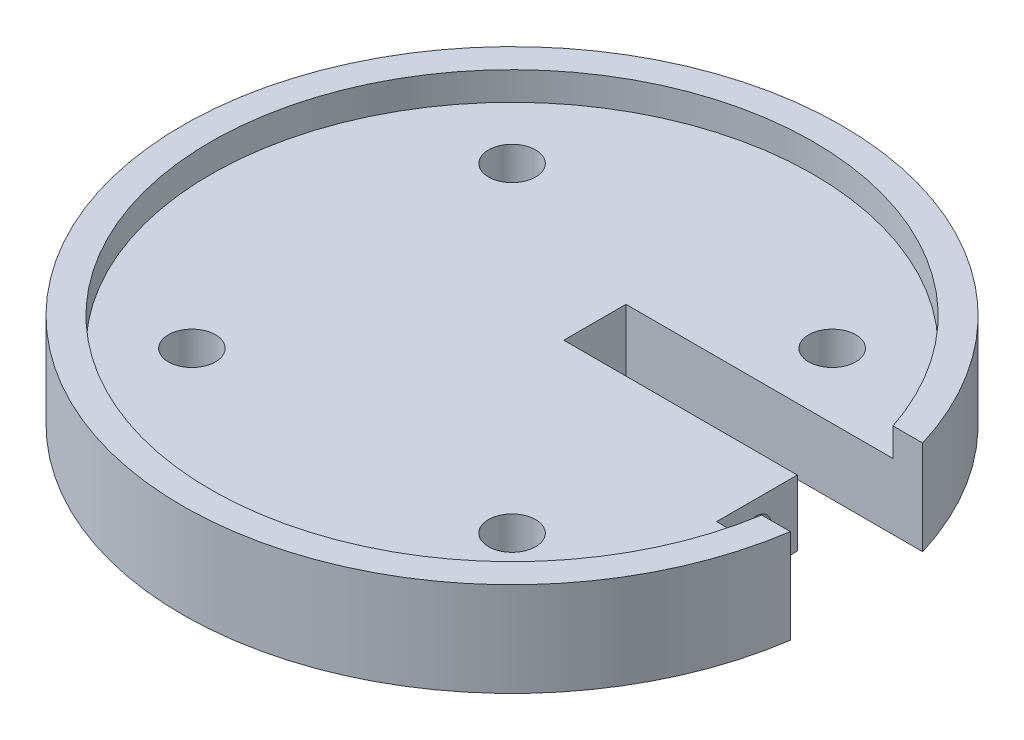
from build123d import *

# Parameters (mm, degrees)
SKETCH1_R               = 35
BOSS_EXTRUDE1_DEPTH     = 10
SKETCH27_W              = 8.45046724
SKETCH27_H              = 8.572937779
CUT_EXTRUDE8_DEPTH      = 51.497524692
CUT_EXTRUDE9_DEPTH      = 51.497524692
CUT_EXTRUDE9_DEPTH_BACK = 51.497524692
SKETCH34_R              = 2.5
SKETCH35_R              = 2.5
CUT_EXTRUDE10_DEPTH     = 51.497524692
SKETCH36_R              = 2.5
CUT_EXTRUDE11_DEPTH     = 51.497524692
SKETCH37_R              = 2.5
CUT_EXTRUDE12_DEPTH     = 51.497524692
SKETCH39_R              = 32
CUT_EXTRUDE14_DEPTH     = 3
SKETCH40_R              = 1.6
CUT_EXTRUDE16_DEPTH     = 35
SKETCH49_W              = 3
SKETCH49_H              = 26.802326962
CUT_EXTRUDE18_DEPTH     = 51.49752485


with BuildPart() as part:
    # Sketch1 → Boss-Extrude1 (new body)
    with BuildSketch(Plane(origin=(0, 0, 0), x_dir=(1, 0, 0), z_dir=(0, 1, 0))):
        with Locations(Location((0, 0, 0), (0, 0, 270))):
            Circle(SKETCH1_R)
    extrude(amount=BOSS_EXTRUDE1_DEPTH)

    # Sketch27 → Cut-Extrude8 (cut, through all)
    with BuildSketch(Plane(origin=(0, 10, 0), x_dir=(1, 0, 0), z_dir=(0, 1, 0))):
        with Locations((31.027560582, -0.794372815)):
            Rectangle(SKETCH27_W, SKETCH27_H)
    extrude(amount=-CUT_EXTRUDE8_DEPTH, mode=Mode.SUBTRACT)

    # Sketch34 → Cut-Extrude9 (cut, two sides: drawn at the far end of the back side and taken through both)
    with BuildSketch(Plane(origin=(0, 10, 0), x_dir=(1, 0, 0), z_dir=(0, 1, 0)).offset(-CUT_EXTRUDE9_DEPTH_BACK)):
        with Locations(Location((-17, 17, 0), (0, 0, 270))):
            Circle(SKETCH34_R)
    extrude(amount=CUT_EXTRUDE9_DEPTH + CUT_EXTRUDE9_DEPTH_BACK, mode=Mode.SUBTRACT)

    # Sketch35 → Cut-Extrude10 (cut, through all)
    with BuildSketch(Plane(origin=(0, 0, 0), x_dir=(-1, 0, 0), z_dir=(0, -1, 0))):
        with Locations(Location((-17, 17, 0), (0, 0, 90))):
            Circle(SKETCH35_R)
    extrude(amount=-CUT_EXTRUDE10_DEPTH, mode=Mode.SUBTRACT)

    # Sketch36 → Cut-Extrude11 (cut, through all)
    with BuildSketch(Plane(origin=(0, 0, 0), x_dir=(-1, 0, 0), z_dir=(0, -1, 0))):
        with Locations(Location((17, -17, 0), (0, 0, 90))):
            Circle(SKETCH36_R)
    extrude(amount=-CUT_EXTRUDE11_DEPTH, mode=Mode.SUBTRACT)

    # Sketch37 → Cut-Extrude12 (cut, through all)
    with BuildSketch(Plane.XZ):
        with Locations(Location((17, 17, 0), (0, 0, 270))):
            Circle(SKETCH37_R)
    extrude(amount=-CUT_EXTRUDE12_DEPTH, mode=Mode.SUBTRACT)

    # Sketch39 → Cut-Extrude14 (cut)
    with BuildSketch(Plane(origin=(0, 10, 0), x_dir=(1, 0, 0), z_dir=(0, 1, 0))):
        Circle(SKETCH39_R)
    extrude(amount=-CUT_EXTRUDE14_DEPTH, mode=Mode.SUBTRACT)

    # Sketch40 → Cut-Extrude16 (cut)
    with BuildSketch(Plane(origin=(26.802326962, 0, 0), x_dir=(0, 0, -1), z_dir=(1, 0, 0))):
        with Locations((-0.847360281, 3.801055622)):
            Circle(SKETCH40_R)
    extrude(amount=-CUT_EXTRUDE16_DEPTH, mode=Mode.SUBTRACT)

    # Sketch49 → Ø6.0mm Dowel Hole6 (revolve, cut)
    with BuildSketch(Plane(origin=(-8.197673038, 3.801055622, 0.847360281), x_dir=(0, 0, -1), z_dir=(0, 1, 0))):
        with Locations((1.5, 13.401163481)):
            Rectangle(SKETCH49_W, SKETCH49_H)
    revolve(axis=Axis((-1.847673038, 3.801055622, 0.847360281), (-1, 0, 0)), mode=Mode.SUBTRACT)

    # Sketch52 → Cut-Extrude18 (cut, through all)
    with BuildSketch(Plane(origin=(0, 0, 0), x_dir=(-1, 0, 0), z_dir=(0, -1, 0))):
        Polygon((-26.802326962, 3.492096074), (-1.999842463, 3.492096074), (-1.999842463, 10.092096074), (-33.513424129, 10.092096074), (-39.471976124, 10.092096074), (-42.019310815, 10.092096074), (-42.019310815, 3.492096074), align=None)
    extrude(amount=-CUT_EXTRUDE18_DEPTH, mode=Mode.SUBTRACT)


solid = part.part
